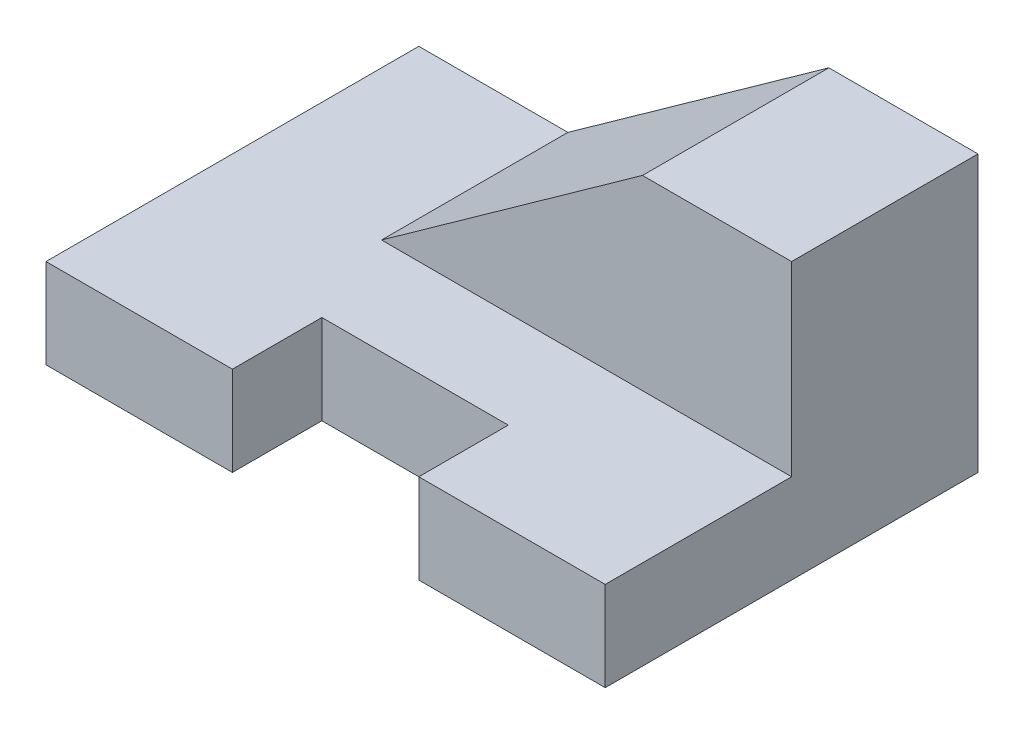
from build123d import *

# Parameters (mm, degrees)
SKETCH1_W           = 75
SKETCH1_H           = 50
BOSS_EXTRUDE1_DEPTH = 12
CUT_EXTRUDE1_REACH  = 92.934
SKETCH3_W           = 25
SKETCH3_H           = 24
BOSS_EXTRUDE2_DEPTH = 25


with BuildPart() as part:
    # Sketch1 → Boss-Extrude1 (new body)
    with BuildSketch(Plane(origin=(0, 0, 0), x_dir=(1, 0, 0), z_dir=(0, 1, 0))):
        with Locations((37.5, 25)):
            Rectangle(SKETCH1_W, SKETCH1_H)
    extrude(amount=BOSS_EXTRUDE1_DEPTH)

    # Sketch3 → Cut-Extrude1 (cut, up to next)
    with BuildSketch(Plane(origin=(0, 12, 0), x_dir=(1, 0, 0), z_dir=(0, 1, 0)), mode=Mode.PRIVATE) as cut_extrude1_sk1:
        with Locations((37.5, 0)):
            Rectangle(SKETCH3_W, SKETCH3_H)
    cut_extrude1_tool1 = extrude(cut_extrude1_sk1.sketch, amount=-CUT_EXTRUDE1_REACH, mode=Mode.PRIVATE) & part.part
    add(cut_extrude1_tool1.solids().sort_by_distance((37.5, 12, 0))[0], mode=Mode.SUBTRACT)

    # Sketch5 → Boss-Extrude2 (add)
    with BuildSketch(Plane(origin=(0, 0, -50), x_dir=(-1, 0, 0), z_dir=(0, 0, -1))):
        Polygon((-75, 12), (-75, 37), (-55, 37), (-20, 12), align=None)
    extrude(amount=-BOSS_EXTRUDE2_DEPTH)


solid = part.part
